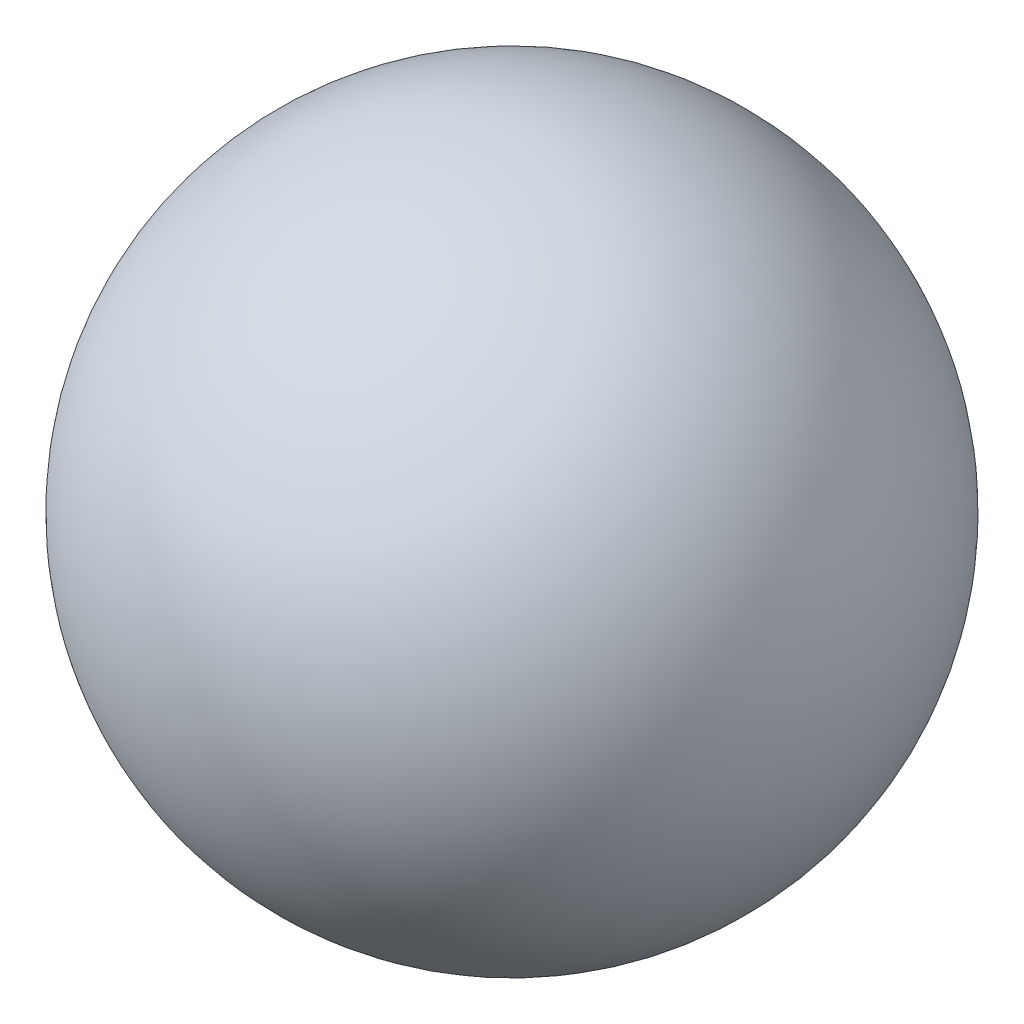
from build123d import *


with BuildPart() as part:
    # Sketch1 → Revolve4 (revolve)
    with BuildSketch(Plane(origin=(0, 0, 0), x_dir=(1, 0, 0), z_dir=(0, 1, 0))):
        with BuildLine():
            Line((0, 0), (0, -76.2))
            ThreePointArc((0, -76.2), (-38.1, -38.1), (0, 0))
        make_face()
    revolve(axis=Axis((0, 0, 0), (0, 0, 1)))


solid = part.part
